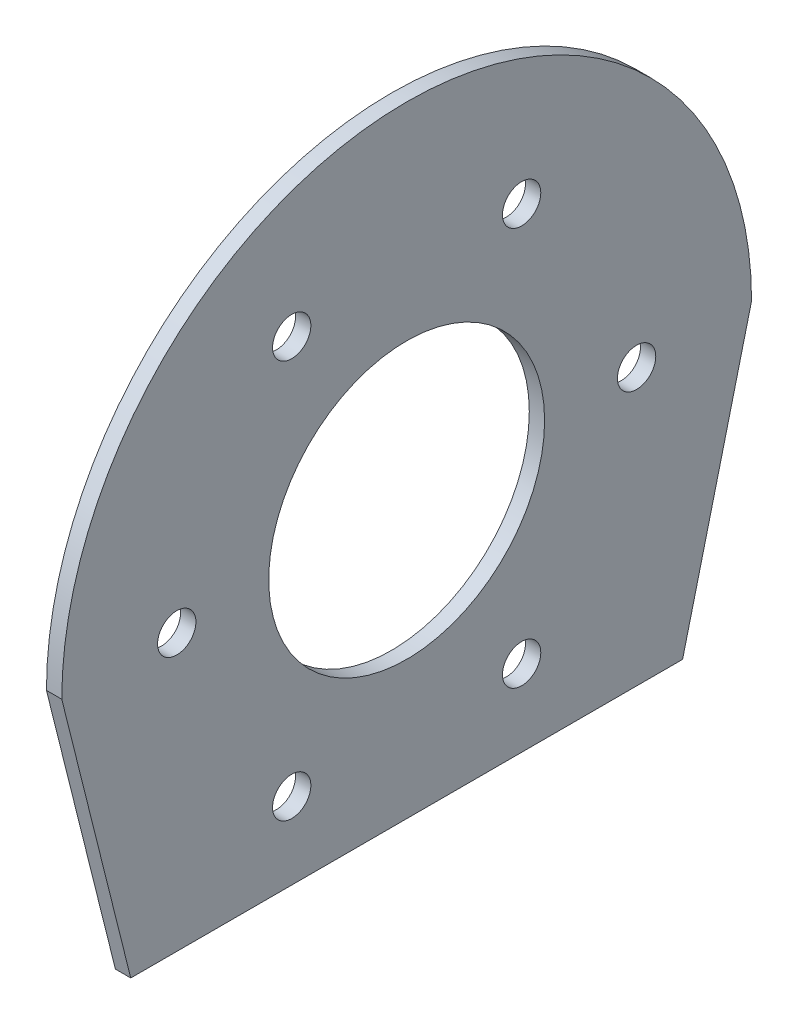
from build123d import *

# Parameters (mm, degrees)
SKETCH1_R           = 9
BOSS_EXTRUDE1_DEPTH = 0.5
SKETCH2_R           = 1.25
CUT_EXTRUDE1_DEPTH  = 1


with BuildPart() as part:
    # Sketch1 → Boss-Extrude1 (new, symmetric)
    with BuildSketch(Plane(origin=(0, 0, 0), x_dir=(0, 0, -1), z_dir=(1, 0, 0))):
        with BuildLine():
            Line((-18, -18), (18, -18))
            Line((18, -18), (22.5, 0))
            ThreePointArc((22.5, 0), (0, 22.5), (-22.5, 0))
            Line((-22.5, 0), (-18, -18))
        make_face()
        Circle(SKETCH1_R, mode=Mode.SUBTRACT)
    extrude(amount=BOSS_EXTRUDE1_DEPTH, both=True)

    # Sketch2 → Cut-Extrude1 (cut)
    with BuildSketch(Plane(origin=(0.5, 0, 0), x_dir=(0, 0, -1), z_dir=(1, 0, 0))):
        with Locations((15, 0)):
            Circle(SKETCH2_R)
        with Locations((7.5, -12.990381057)):
            Circle(SKETCH2_R)
        with Locations((-7.5, -12.990381057)):
            Circle(SKETCH2_R)
        with Locations((-15, 0)):
            Circle(SKETCH2_R)
        with Locations((-7.5, 12.990381057)):
            Circle(SKETCH2_R)
        with Locations((7.5, 12.990381057)):
            Circle(SKETCH2_R)
    extrude(amount=-CUT_EXTRUDE1_DEPTH, mode=Mode.SUBTRACT)


solid = part.part
